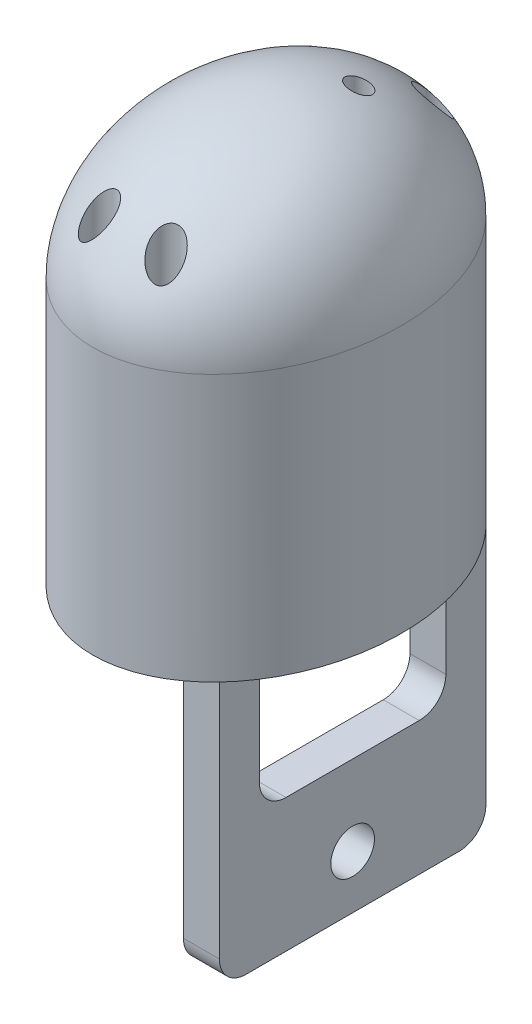
from build123d import *

# Parameters (mm, degrees)
SKETCH1_W           = 2.7
SKETCH1_H           = 20
BOSS_EXTRUDE1_DEPTH = 20
SKETCH4_RX          = 13
SKETCH4_RY          = 10.172604586
BOSS_EXTRUDE2_DEPTH = 20
REVOLVE1_ANGLE      = 180
CUT_EXTRUDE1_REACH  = 58.934
SKETCH6_R           = 1.64
SKETCH6_W           = 14
SKETCH6_H           = 10
FILLET1_R           = 2
CUT_REVOLVE5_ANGLE  = 180
SKETCH11_R          = 0.86
SKETCH11_R_2        = 1.125
CUT_EXTRUDE5_DEPTH  = 29.98707334


with BuildPart() as part:
    # Sketch1 → Boss-Extrude1 (new body)
    with BuildSketch(Plane(origin=(0, 0, 0), x_dir=(1, 0, 0), z_dir=(0, 1, 0))):
        with Locations((5.15, 10)):
            Rectangle(SKETCH1_W, SKETCH1_H)
    extrude(amount=BOSS_EXTRUDE1_DEPTH)

    # Sketch4 → Boss-Extrude2 (add)
    with BuildSketch(Plane(origin=(0, 20, 0), x_dir=(1, 0, 0), z_dir=(0, 1, 0))):
        with Locations(Location((0, 10), (0, 0, 90))):
            Ellipse(SKETCH4_RX, SKETCH4_RY)
    extrude(amount=BOSS_EXTRUDE2_DEPTH)

    # Sketch5 → Revolve1 (revolve)
    with BuildSketch(Plane(origin=(0, 40, 0), x_dir=(1, 0, 0), z_dir=(0, 1, 0))):
        with BuildLine():
            Line((0, 23), (0, -3))
            add(Edge.make_bspline(
                [(0, -3), (10.172604586, -3.000000114), (10.172604586, 9.999999968), (10.172604586, 23.00000005), (0, 23)],
                knots=[6.283185294, 6.283185294, 6.283185294, 7.853981628, 7.853981628, 9.424777961, 9.424777961, 9.424777961], degree=2, weights=[1, 0.707106779, 1, 0.707106779, 1]))
        make_face()
    revolve(axis=Axis((0, 40, -23), (0, 0, 1)), revolution_arc=REVOLVE1_ANGLE)

    # Sketch6 → Cut-Extrude1 (cut, up to next)
    with BuildSketch(Plane.ZY.offset(-3.8), mode=Mode.PRIVATE) as cut_extrude1_sk1:
        with Locations((-10, 4)):
            Circle(SKETCH6_R)
    cut_extrude1_tool1 = extrude(cut_extrude1_sk1.sketch, amount=-CUT_EXTRUDE1_REACH, mode=Mode.PRIVATE) & part.part
    # Sketch6 → Cut-Extrude1 (cut, up to next)
    with BuildSketch(Plane.ZY.offset(-3.8), mode=Mode.PRIVATE) as cut_extrude1_sk2:
        with Locations((-10, 15)):
            Rectangle(SKETCH6_W, SKETCH6_H)
    cut_extrude1_tool2 = extrude(cut_extrude1_sk2.sketch, amount=-CUT_EXTRUDE1_REACH, mode=Mode.PRIVATE) & part.part
    add(cut_extrude1_tool1.solids().sort_by_distance((3.8, 4, -10))[0], mode=Mode.SUBTRACT)
    add(cut_extrude1_tool2.solids().sort_by_distance((3.8, 15, -10))[0], mode=Mode.SUBTRACT)

    # Fillet1
    fillet1_edges = [part.edges().sort_by_distance(p)[0] for p in [
        (5.15, 10, -17),
        (5.15, 10, -3),
        (5.15, 0, -20),
        (5.15, 0, 0),
    ]]
    fillet(fillet1_edges, radius=FILLET1_R)

    # Sketch10 → Cut-Revolve5 (revolve, cut)
    with BuildSketch(Plane.XZ.offset(-20)):
        with BuildLine():
            Line((0, 0), (0, -20))
            add(Edge.make_bspline(
                [(0, -20), (5.321064319, -20), (5.321064319, -10), (5.321064319, 0), (0, 0)],
                knots=[0, 0, 0, 1.570796327, 1.570796327, 3.141592654, 3.141592654, 3.141592654], degree=2, weights=[1, 0.707106781, 1, 0.707106781, 1]))
        make_face()
    revolve(axis=Axis((0, 20, 0), (0, 0, 1)), revolution_arc=CUT_REVOLVE5_ANGLE, mode=Mode.SUBTRACT)

    # Sketch11 → Cut-Extrude5 (cut)
    with BuildSketch(Plane(origin=(0, 20, 0), x_dir=(-1, 0, 0), z_dir=(0, -1, 0))):
        with Locations(Location((-2.13, 14.83, 0), (0, 0, 90))):
            Circle(SKETCH11_R)
        with Locations(Location((-2.5, 20, 0), (0, 0, 90))):
            Circle(SKETCH11_R_2)
        with Locations(Location((2.5, 20, 0), (0, 0, 90))):
            Circle(SKETCH11_R_2)
        with Locations(Location((-2.5, 0, 0), (0, 0, 90))):
            Circle(SKETCH11_R_2)
        with Locations(Location((2.5, 0, 0), (0, 0, 90))):
            Circle(SKETCH11_R_2)
    extrude(amount=-CUT_EXTRUDE5_DEPTH, mode=Mode.SUBTRACT)


solid = part.part
